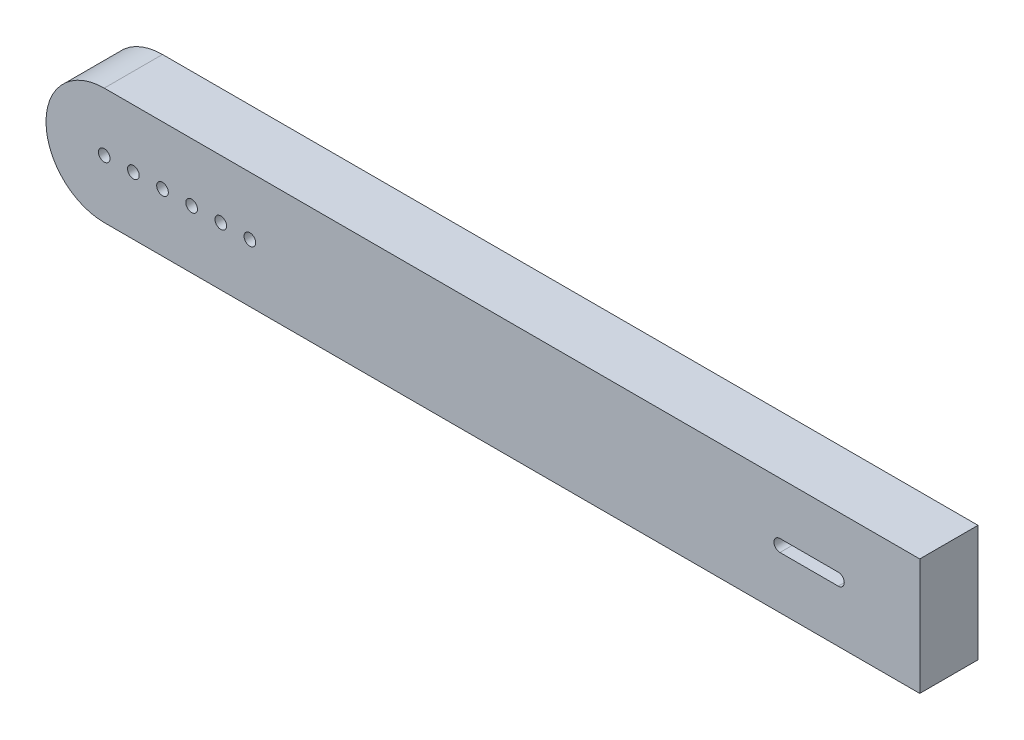
from build123d import *

# Parameters (mm, degrees)
BOSS_EXTRUDE3_DEPTH = 6.35
CUT_EXTRUDE2_DEPTH  = 25.4


with BuildPart() as part:
    # Sketch1 → Boss-Extrude3 (new body)
    # profile 1 of 2: a face of its own
    with BuildSketch(Plane.XY):
        with BuildLine():
            ThreePointArc((-40.954752736, 5.850678962), (-47.304752736, -0.499321038), (-40.954752736, -6.849321038))
            Line((-40.954752736, -6.849321038), (47.945247264, -6.849321038))
            Line((47.945247264, -6.849321038), (47.945247264, 5.850678962))
            Line((47.945247264, 5.850678962), (-40.954752736, 5.850678962))
        make_face()
        with BuildLine():
            ThreePointArc((-40.319752736, -0.499321038), (-40.954490658, -1.134320984), (-41.589752519, -0.499845193))
            ThreePointArc((-41.589752519, -0.499845193), (-40.955276891, 0.135678746), (-40.319752952, -0.498796882))
            ThreePointArc((-40.319752952, -0.498796882), (-40.31975279, -0.49905896), (-40.319752736, -0.499321038))
        make_face(mode=Mode.SUBTRACT)
        with BuildLine():
            Line((-37.144752749, -0.499189999), (-37.144752736, -0.499321038))
            ThreePointArc((-37.144752736, -0.499321038), (-38.414752732, -0.499386557), (-37.144752749, -0.499189999))
        make_face(mode=Mode.SUBTRACT)
        with BuildLine():
            ThreePointArc((-33.969752736, -0.499321038), (-34.604752736, -1.134321038), (-35.239752736, -0.499321038))
            ThreePointArc((-35.239752736, -0.499321038), (-34.604752736, 0.135678962), (-33.969752736, -0.499321038))
        make_face(mode=Mode.SUBTRACT)
        with BuildLine():
            ThreePointArc((-30.794752736, -0.499321038), (-31.429752736, -1.134321038), (-32.064752736, -0.499321038))
            ThreePointArc((-32.064752736, -0.499321038), (-31.429752736, 0.135678962), (-30.794752736, -0.499321038))
        make_face(mode=Mode.SUBTRACT)
        with BuildLine():
            ThreePointArc((-27.619752736, -0.499321038), (-28.254752736, -1.134321038), (-28.889752736, -0.499321038))
            ThreePointArc((-28.889752736, -0.499321038), (-28.254752736, 0.135678962), (-27.619752736, -0.499321038))
        make_face(mode=Mode.SUBTRACT)
        with BuildLine():
            ThreePointArc((-24.444752736, -0.499321038), (-25.079752736, -1.134321038), (-25.714752736, -0.499321038))
            ThreePointArc((-25.714752736, -0.499321038), (-25.079752736, 0.135678962), (-24.444752736, -0.499321038))
        make_face(mode=Mode.SUBTRACT)
        with BuildLine():
            ThreePointArc((32.070247264, -0.499321038), (32.705247264, 0.135678962), (33.340247264, -0.499321038))
            ThreePointArc((33.340247264, -0.499321038), (32.705247264, -1.134321038), (32.070247264, -0.499321038))
        make_face(mode=Mode.SUBTRACT)
        with BuildLine():
            ThreePointArc((35.245247264, -0.499321038), (35.880247264, 0.135678962), (36.515247264, -0.499321038))
            ThreePointArc((36.515247264, -0.499321038), (35.880247264, -1.134321038), (35.245247264, -0.499321038))
        make_face(mode=Mode.SUBTRACT)
        with BuildLine():
            ThreePointArc((38.420247264, -0.499321038), (39.055247264, 0.135678962), (39.690247264, -0.499321038))
            ThreePointArc((39.690247264, -0.499321038), (39.055247264, -1.134321038), (38.420247264, -0.499321038))
        make_face(mode=Mode.SUBTRACT)
    # profile 2 of 2: a face of its own
    with BuildSketch(Plane.XY):
        with BuildLine():
            ThreePointArc((-40.954752736, 5.850678962), (-47.304752736, -0.499321038), (-40.954752736, -6.849321038))
            Line((-40.954752736, -6.849321038), (47.945247264, -6.849321038))
            Line((47.945247264, -6.849321038), (47.945247264, 5.850678962))
            Line((47.945247264, 5.850678962), (-40.954752736, 5.850678962))
        make_face()
        with BuildLine():
            ThreePointArc((-40.319752736, -0.499321038), (-40.954490658, -1.134320984), (-41.589752519, -0.499845193))
            ThreePointArc((-41.589752519, -0.499845193), (-40.955276891, 0.135678746), (-40.319752952, -0.498796882))
            ThreePointArc((-40.319752952, -0.498796882), (-40.31975279, -0.49905896), (-40.319752736, -0.499321038))
        make_face(mode=Mode.SUBTRACT)
        with BuildLine():
            Line((-37.144752749, -0.499189999), (-37.144752736, -0.499321038))
            ThreePointArc((-37.144752736, -0.499321038), (-38.414752732, -0.499386557), (-37.144752749, -0.499189999))
        make_face(mode=Mode.SUBTRACT)
        with BuildLine():
            ThreePointArc((-33.969752736, -0.499321038), (-34.604752736, -1.134321038), (-35.239752736, -0.499321038))
            ThreePointArc((-35.239752736, -0.499321038), (-34.604752736, 0.135678962), (-33.969752736, -0.499321038))
        make_face(mode=Mode.SUBTRACT)
        with BuildLine():
            ThreePointArc((-30.794752736, -0.499321038), (-31.429752736, -1.134321038), (-32.064752736, -0.499321038))
            ThreePointArc((-32.064752736, -0.499321038), (-31.429752736, 0.135678962), (-30.794752736, -0.499321038))
        make_face(mode=Mode.SUBTRACT)
        with BuildLine():
            ThreePointArc((-27.619752736, -0.499321038), (-28.254752736, -1.134321038), (-28.889752736, -0.499321038))
            ThreePointArc((-28.889752736, -0.499321038), (-28.254752736, 0.135678962), (-27.619752736, -0.499321038))
        make_face(mode=Mode.SUBTRACT)
        with BuildLine():
            ThreePointArc((-24.444752736, -0.499321038), (-25.079752736, -1.134321038), (-25.714752736, -0.499321038))
            ThreePointArc((-25.714752736, -0.499321038), (-25.079752736, 0.135678962), (-24.444752736, -0.499321038))
        make_face(mode=Mode.SUBTRACT)
        with BuildLine():
            ThreePointArc((32.070247264, -0.499321038), (32.705247264, 0.135678962), (33.340247264, -0.499321038))
            ThreePointArc((33.340247264, -0.499321038), (32.705247264, -1.134321038), (32.070247264, -0.499321038))
        make_face(mode=Mode.SUBTRACT)
        with BuildLine():
            ThreePointArc((35.245247264, -0.499321038), (35.880247264, 0.135678962), (36.515247264, -0.499321038))
            ThreePointArc((36.515247264, -0.499321038), (35.880247264, -1.134321038), (35.245247264, -0.499321038))
        make_face(mode=Mode.SUBTRACT)
        with BuildLine():
            ThreePointArc((38.420247264, -0.499321038), (39.055247264, 0.135678962), (39.690247264, -0.499321038))
            ThreePointArc((39.690247264, -0.499321038), (39.055247264, -1.134321038), (38.420247264, -0.499321038))
        make_face(mode=Mode.SUBTRACT)
    extrude(amount=BOSS_EXTRUDE3_DEPTH)

    # Sketch2 → Cut-Extrude2 (cut)
    with BuildSketch(Plane.XY.offset(6.35)):
        with BuildLine():
            Line((32.705247264, -1.159721038), (39.055247264, -1.159721038))
            ThreePointArc((39.055247264, -1.159721038), (39.715647264, -0.499321038), (39.055247264, 0.161078962))
            Line((39.055247264, 0.161078962), (32.705247264, 0.161078962))
            ThreePointArc((32.705247264, 0.161078962), (32.044847264, -0.499321038), (32.705247264, -1.159721038))
        make_face()
    extrude(amount=-CUT_EXTRUDE2_DEPTH, mode=Mode.SUBTRACT)


solid = part.part
